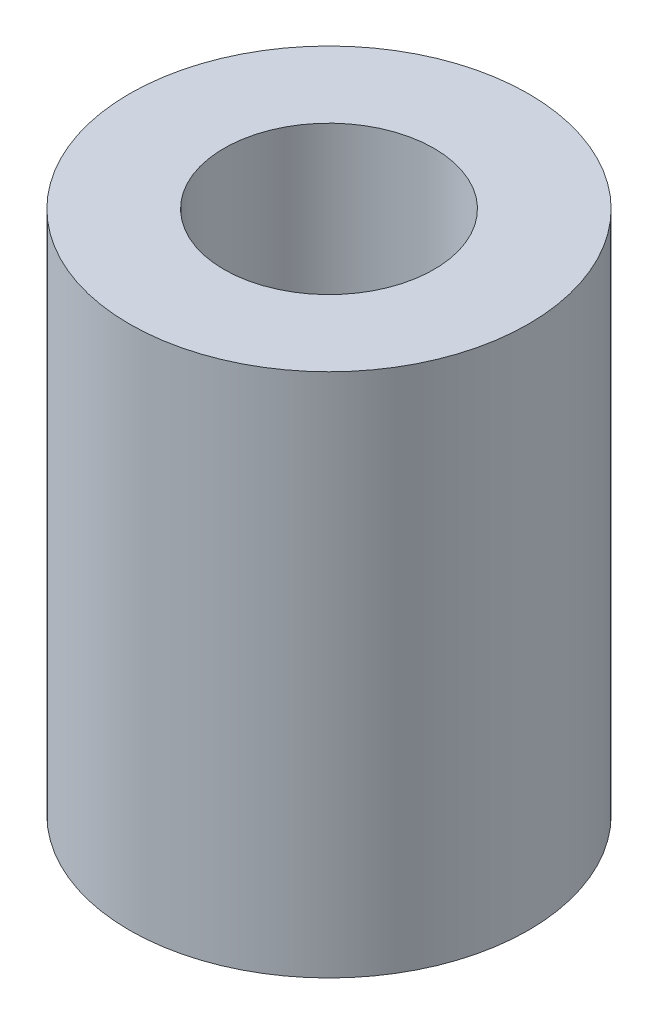
from build123d import *

# Parameters (mm, degrees)
SKETCH1_R           = 9.5
BOSS_EXTRUDE1_DEPTH = 25
SKETCH2_R           = 5
CUT_EXTRUDE1_DEPTH  = 17.5
SKETCH3_R           = 4
CUT_EXTRUDE2_DEPTH  = 23.062411473


with BuildPart() as part:
    # Sketch1 → Boss-Extrude1 (new body)
    with BuildSketch(Plane(origin=(0, 0, 0), x_dir=(1, 0, 0), z_dir=(0, 1, 0))):
        with Locations(Location((0, 0, 0), (0, 0, 270))):
            Circle(SKETCH1_R)
    extrude(amount=BOSS_EXTRUDE1_DEPTH)

    # Sketch2 → Cut-Extrude1 (cut)
    with BuildSketch(Plane(origin=(0, 25, 0), x_dir=(1, 0, 0), z_dir=(0, 1, 0))):
        with Locations(Location((0, 0, 0), (0, 0, 270))):
            Circle(SKETCH2_R)
    extrude(amount=-CUT_EXTRUDE1_DEPTH, mode=Mode.SUBTRACT)

    # Sketch3 → Cut-Extrude2 (cut, through all)
    with BuildSketch(Plane(origin=(0, 7.5, 0), x_dir=(1, 0, 0), z_dir=(0, 1, 0))):
        with Locations(Location((0, 0, 0), (0, 0, 270))):
            Circle(SKETCH3_R)
    extrude(amount=-CUT_EXTRUDE2_DEPTH, mode=Mode.SUBTRACT)


solid = part.part
